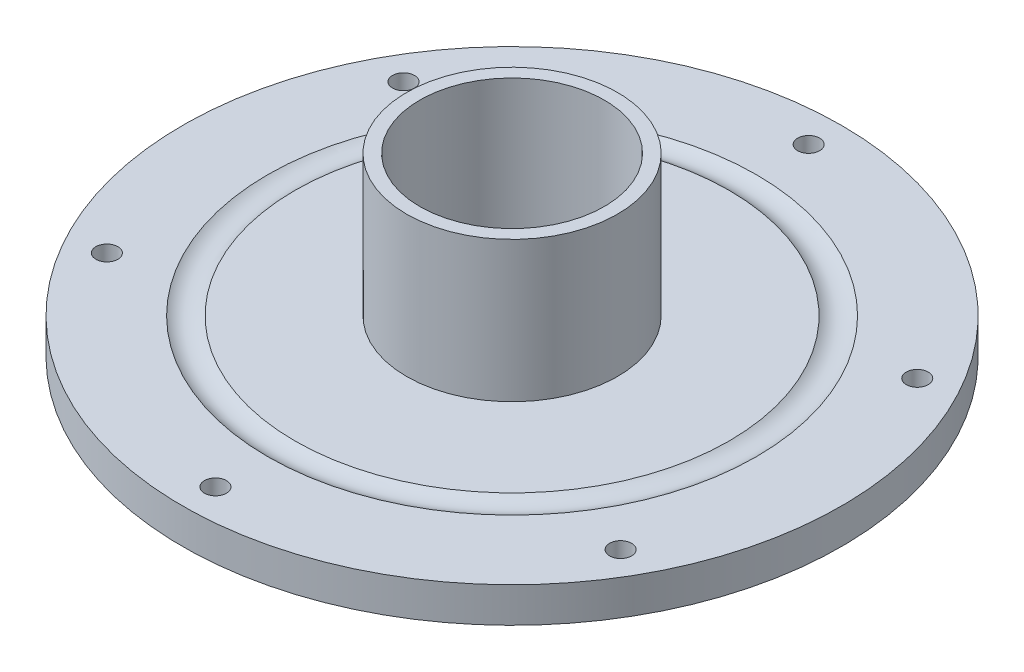
from build123d import *

# Parameters (mm, degrees)
SKETCH2_R           = 75
SKETCH2_R_2         = 59
SKETCH2_R_3         = 47
BOSS_EXTRUDE1_DEPTH = 8
SKETCH4_R           = 2.5
CUT_EXTRUDE1_DEPTH  = 8
SKETCH5_R           = 1.9
CUT_EXTRUDE2_DEPTH  = 8
SKETCH7_R           = 22.5
CUT_EXTRUDE3_DEPTH  = 3
SKETCH8_R           = 24
SKETCH8_R_2         = 21
BOSS_EXTRUDE3_DEPTH = 32
SKETCH9_R           = 2.5
CUT_EXTRUDE4_DEPTH  = 8
SKETCH10_R          = 2
CUT_EXTRUDE7_DEPTH  = 2


with BuildPart() as part:
    # Sketch1 → Revolve1 (revolve)
    with BuildSketch(Plane(origin=(0, 0, 0), x_dir=(-1, 0, 0), z_dir=(0, 0, -1)), mode=Mode.PRIVATE) as revolve1_sk:
        with BuildLine():
            Line((-59, -1.1276), (-47, -1.1276))
            ThreePointArc((-47, -1.1276), (-46.292893219, -0.834706781), (-46, -0.1276))
            Line((-46, -0.1276), (-46, 5.8724))
            Line((-46, 5.8724), (-47, 6.8724))
            Line((-47, 6.8724), (-49.4043, 6.8724))
            ThreePointArc((-49.4043, 6.8724), (-52.5, 5.8405), (-55.5957, 6.8724))
            Line((-55.5957, 6.8724), (-59, 6.8724))
            Line((-59, 6.8724), (-60, 5.8724))
            Line((-60, 5.8724), (-60, -0.1276))
            ThreePointArc((-60, -0.1276), (-59.707106781, -0.834706781), (-59, -1.1276))
        make_face()
    revolve(revolve1_sk.sketch.rotate(Axis((0, 0, 0), (0, 1, 0)), 270), axis=Axis((0, 0, 0), (0, 1, 0)))

    # Sketch2 → Boss-Extrude1 (add)
    # profile 1 of 2: a face of its own
    with BuildSketch(Plane.XZ.offset(1.1276)):
        with Locations(Location((0, 0, 0), (0, 0, 270))):
            Circle(SKETCH2_R)
        Circle(SKETCH2_R_2, mode=Mode.SUBTRACT)
    # profile 2 of 2: a face of its own
    with BuildSketch(Plane.XZ.offset(1.1276)):
        Circle(SKETCH2_R_3)
    extrude(amount=-BOSS_EXTRUDE1_DEPTH)

    # Sketch4 → Cut-Extrude1 (cut)
    with BuildSketch(Plane.XZ.offset(1.1276)):
        with Locations(Location((0, 0, 0), (0, 0, 270))):
            Circle(SKETCH4_R)
    extrude(amount=-CUT_EXTRUDE1_DEPTH, mode=Mode.SUBTRACT)

    # Sketch5 → Cut-Extrude2 (cut)
    with BuildSketch(Plane.XZ.offset(1.1276)):
        with Locations(Location((0, 17.5, 0), (0, 0, 270))):
            Circle(SKETCH5_R)
        with Locations(Location((17.5, 0, 0), (0, 0, 270))):
            Circle(SKETCH5_R)
        with Locations(Location((0, -17.5, 0), (0, 0, 270))):
            Circle(SKETCH5_R)
        with Locations(Location((-17.5, 0, 0), (0, 0, 270))):
            Circle(SKETCH5_R)
    extrude(amount=-CUT_EXTRUDE2_DEPTH, mode=Mode.SUBTRACT)

    # Sketch7 → Cut-Extrude3 (cut)
    with BuildSketch(Plane.XZ.offset(1.1276)):
        with Locations(Location((0, 0, 0), (0, 0, 270))):
            Circle(SKETCH7_R)
    extrude(amount=-CUT_EXTRUDE3_DEPTH, mode=Mode.SUBTRACT)

    # Sketch8 → Boss-Extrude3 (add)
    with BuildSketch(Plane(origin=(0, 6.8724, 0), x_dir=(1, 0, 0), z_dir=(0, 1, 0))):
        with Locations(Location((0, 0, 0), (0, 0, 270))):
            Circle(SKETCH8_R)
        with Locations(Location((0, 0, 0), (0, 0, 270))):
            Circle(SKETCH8_R_2, mode=Mode.SUBTRACT)
    extrude(amount=BOSS_EXTRUDE3_DEPTH)

    # Sketch9 → Cut-Extrude4 (cut)
    with BuildSketch(Plane.XZ.offset(1.1276)):
        with Locations(Location((0, -67.5, 0), (0, 0, 270))):
            Circle(SKETCH9_R)
        with Locations(Location((-58.456714755, -33.75, 0), (0, 0, 270))):
            Circle(SKETCH9_R)
        with Locations(Location((-58.456714755, 33.75, 0), (0, 0, 270))):
            Circle(SKETCH9_R)
        with Locations(Location((0, 67.5, 0), (0, 0, 270))):
            Circle(SKETCH9_R)
        with Locations(Location((58.456714755, 33.75, 0), (0, 0, 270))):
            Circle(SKETCH9_R)
        with Locations(Location((58.456714755, -33.75, 0), (0, 0, 270))):
            Circle(SKETCH9_R)
    extrude(amount=-CUT_EXTRUDE4_DEPTH, mode=Mode.SUBTRACT)

    # Sketch10 → Cut-Extrude7 (cut)
    with BuildSketch(Plane.XZ.offset(1.1276)):
        with Locations(Location((-15.100458433, 42.880887256, 0), (0, 0, 270))):
            Circle(SKETCH10_R)
        with Locations(Location((21.160611362, 39.745183733, 0), (0, 0, 270))):
            Circle(SKETCH10_R)
        with Locations(Location((-40.950984141, 20.176327665, 0), (0, 0, 270))):
            Circle(SKETCH10_R)
        with Locations(Location((-42.219460081, -16.197959793, 0), (0, 0, 270))):
            Circle(SKETCH10_R)
    extrude(amount=-CUT_EXTRUDE7_DEPTH, mode=Mode.SUBTRACT)


solid = part.part
